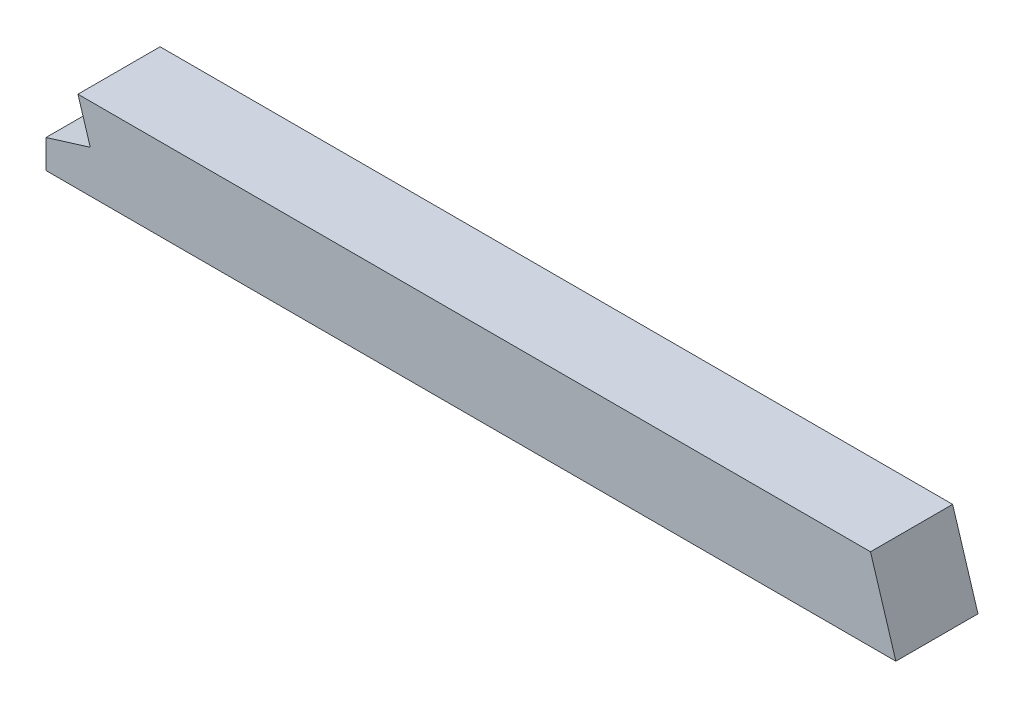
from build123d import *

# Parameters (mm, degrees)
SKETCH1_W               = 38.1
SKETCH1_H               = 38.1
BOSS_EXTRUDE1_DEPTH     = 394.2334
CUT_EXTRUDE1_DEPTH      = 397.528039583
CUT_EXTRUDE2_DEPTH      = 397.528039583
CUT_EXTRUDE2_DEPTH_BACK = 397.528039583


with BuildPart() as part:
    # Sketch1 → Boss-Extrude1 (new body)
    with BuildSketch(Plane(origin=(0, 0, 0), x_dir=(0, 0, -1), z_dir=(1, 0, 0))):
        Rectangle(SKETCH1_W, SKETCH1_H)
    extrude(amount=BOSS_EXTRUDE1_DEPTH)

    # Sketch2 → Cut-Extrude1 (cut, through all)
    with BuildSketch(Plane.XY.offset(19.05)):
        Polygon((394.2334, -19.05), (382.468621152, 19.05), (394.2334, 19.05), align=None)
    extrude(amount=-CUT_EXTRUDE1_DEPTH, mode=Mode.SUBTRACT)

    # Sketch3 → Cut-Extrude2 (cut, two sides: drawn at the far end of the back side and taken through both)
    with BuildSketch(Plane.XY.offset(19.05).offset(-CUT_EXTRUDE2_DEPTH_BACK)):
        Polygon((0, 19.05), (0, -5.758314958), (20.522286578, 0.578697196), (14.818591236, 19.05), align=None)
    extrude(amount=CUT_EXTRUDE2_DEPTH + CUT_EXTRUDE2_DEPTH_BACK, mode=Mode.SUBTRACT)


solid = part.part
